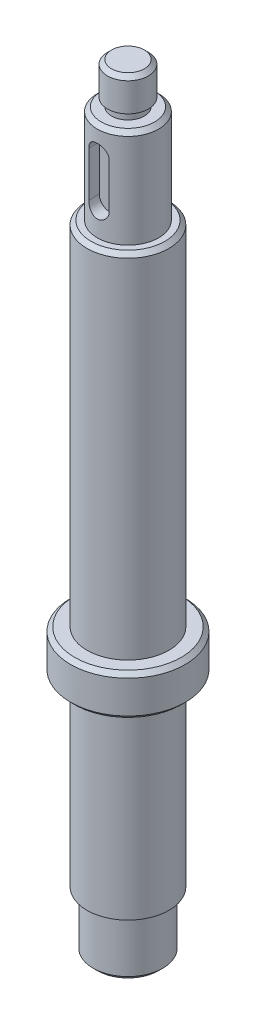
from build123d import *

# Parameters (mm, degrees)
CHAMFER1_SIZE      = 1
CUT_EXTRUDE1_DEPTH = 3
CUT_EXTRUDE2_DEPTH = 3.5


with BuildPart() as part:
    # Sketch1 → Revolve1 (revolve)
    with BuildSketch(Plane.XY, mode=Mode.PRIVATE) as revolve1_sk:
        Polygon((0, 0), (0, -189), (-8.5, -189), (-8.5, -175), (-10, -175), (-10, -130), (-14, -130), (-14, -120), (-10, -120), (-10, -34), (-7.5, -34), (-7.5, -10), (-4, -10), (-4, -8), (-5, -8), (-5, 0), align=None)
    revolve(revolve1_sk.sketch.rotate(Axis((0, 0, 0), (0, -1, 0)), 270), axis=Axis((0, 0, 0), (0, -1, 0)))

    # Chamfer1
    chamfer1_edges = [part.edges().sort_by_distance(p)[0] for p in [
        (0, -189, -8.5),
        (0, -130, -14),
        (0, -120, -14),
        (0, -34, -10),
        (0, -10, -7.5),
        (0, 0, -5),
    ]]
    chamfer(chamfer1_edges, length=CHAMFER1_SIZE)

    # Sketch2 → Cut-Extrude1 (cut)
    with BuildSketch(Plane.XY.offset(7.5)):
        with BuildLine():
            Line((2.5, -16.5), (2.5, -27.5))
            ThreePointArc((2.5, -27.5), (0, -30), (-2.5, -27.5))
            Line((-2.5, -27.5), (-2.5, -16.5))
            ThreePointArc((-2.5, -16.5), (0, -14), (2.5, -16.5))
        make_face()
    extrude(amount=-CUT_EXTRUDE1_DEPTH, mode=Mode.SUBTRACT)

    # Sketch3 → Cut-Extrude2 (cut)
    with BuildSketch(Plane.XY.offset(-10)):
        with BuildLine():
            Line((-3, -152), (-3, -138))
            ThreePointArc((-3, -138), (0, -135), (3, -138))
            Line((3, -138), (3, -152))
            ThreePointArc((3, -152), (0, -155), (-3, -152))
        make_face()
    extrude(amount=CUT_EXTRUDE2_DEPTH, mode=Mode.SUBTRACT)


solid = part.part
